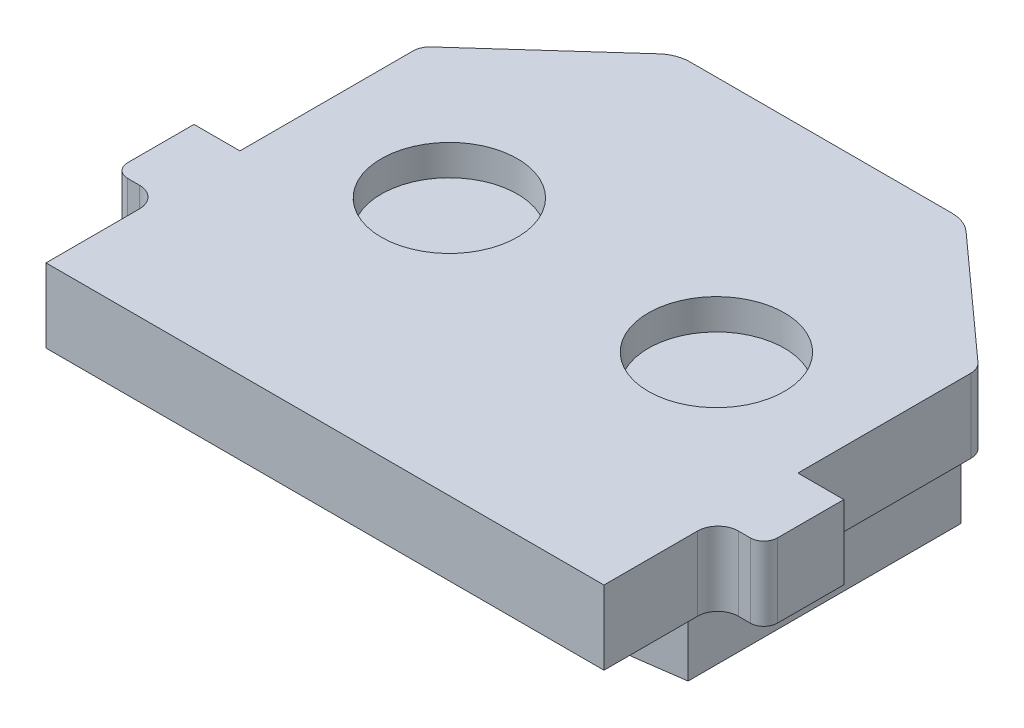
from build123d import *

# Parameters (mm, degrees)
BOSS_EXTRUDE1_DEPTH = 5.5118
SKETCH2_R           = 5.08
CUT_EXTRUDE1_DEPTH  = 2.286
BOSS_EXTRUDE2_DEPTH = 4.6228


with BuildPart() as part:
    # Sketch1 → Boss-Extrude1 (new body)
    with BuildSketch(Plane(origin=(0, 0, 0), x_dir=(1, 0, 0), z_dir=(0, 1, 0))):
        with BuildLine():
            ThreePointArc((20.407631134, 9.827266142), (20.718157649, 9.399980692), (20.828, 8.88332391))
            Line((20.828, 8.88332391), (20.828, -4.0386))
            Line((20.828, -4.0386), (24.257, -4.0386))
            Line((24.257, -4.0386), (24.257, -8.9916))
            ThreePointArc((24.257, -8.9916), (23.95942049, -9.71002049), (23.241, -10.0076))
            Line((23.241, -10.0076), (22.352, -10.0076))
            ThreePointArc((22.352, -10.0076), (21.274369265, -10.453969265), (20.828, -11.5316))
            Line((20.828, -11.5316), (20.828, -18.5166))
            Line((20.828, -18.5166), (-20.828, -18.5166))
            Line((-20.828, -18.5166), (-20.828, -11.5316))
            ThreePointArc((-20.828, -11.5316), (-21.274369265, -10.453969265), (-22.352, -10.0076))
            Line((-22.352, -10.0076), (-23.241, -10.0076))
            ThreePointArc((-23.241, -10.0076), (-23.95942049, -9.71002049), (-24.257, -8.9916))
            Line((-24.257, -8.9916), (-24.257, -4.0386))
            Line((-24.257, -4.0386), (-20.828, -4.0386))
            Line((-20.828, -4.0386), (-20.828, 8.88332391))
            ThreePointArc((-20.828, 8.88332391), (-20.718157649, 9.399980692), (-20.407631134, 9.827266142))
            Line((-20.407631134, 9.827266142), (-11.478262268, 17.864484463))
            ThreePointArc((-11.478262268, 17.864484463), (-10.689047654, 18.347973709), (-9.779, 18.5166))
            Line((-9.779, 18.5166), (9.779, 18.5166))
            ThreePointArc((9.779, 18.5166), (10.689047654, 18.347973709), (11.478262268, 17.864484463))
            Line((11.478262268, 17.864484463), (20.407631134, 9.827266142))
        make_face()
    extrude(amount=BOSS_EXTRUDE1_DEPTH)

    # Sketch2 → Cut-Extrude1 (cut)
    with BuildSketch(Plane(origin=(0, 5.5118, 0), x_dir=(1, 0, 0), z_dir=(0, 1, 0))):
        with Locations(Location((-9.9695, 0.7366, 0), (0, 0, 270))):
            Circle(SKETCH2_R)
        with Locations(Location((9.9695, 0.7366, 0), (0, 0, 270))):
            Circle(SKETCH2_R)
    extrude(amount=-CUT_EXTRUDE1_DEPTH, mode=Mode.SUBTRACT)

    # Sketch3 → Boss-Extrude2 (add)
    with BuildSketch(Plane.XZ):
        with BuildLine():
            Line((10.795, -17.2466), (-10.795, -17.2466))
            Line((-10.795, -17.2466), (-20.045633867, -8.920214887))
            Line((-20.045633867, -8.920214887), (-20.045633867, 11.4554))
            ThreePointArc((-20.045633867, 11.4554), (0, 12.967759921), (20.045633867, 11.4554))
            Line((20.045633867, 11.4554), (20.045633867, -8.920214887))
            Line((20.045633867, -8.920214887), (10.795, -17.2466))
        make_face()
    extrude(amount=BOSS_EXTRUDE2_DEPTH)


solid = part.part
